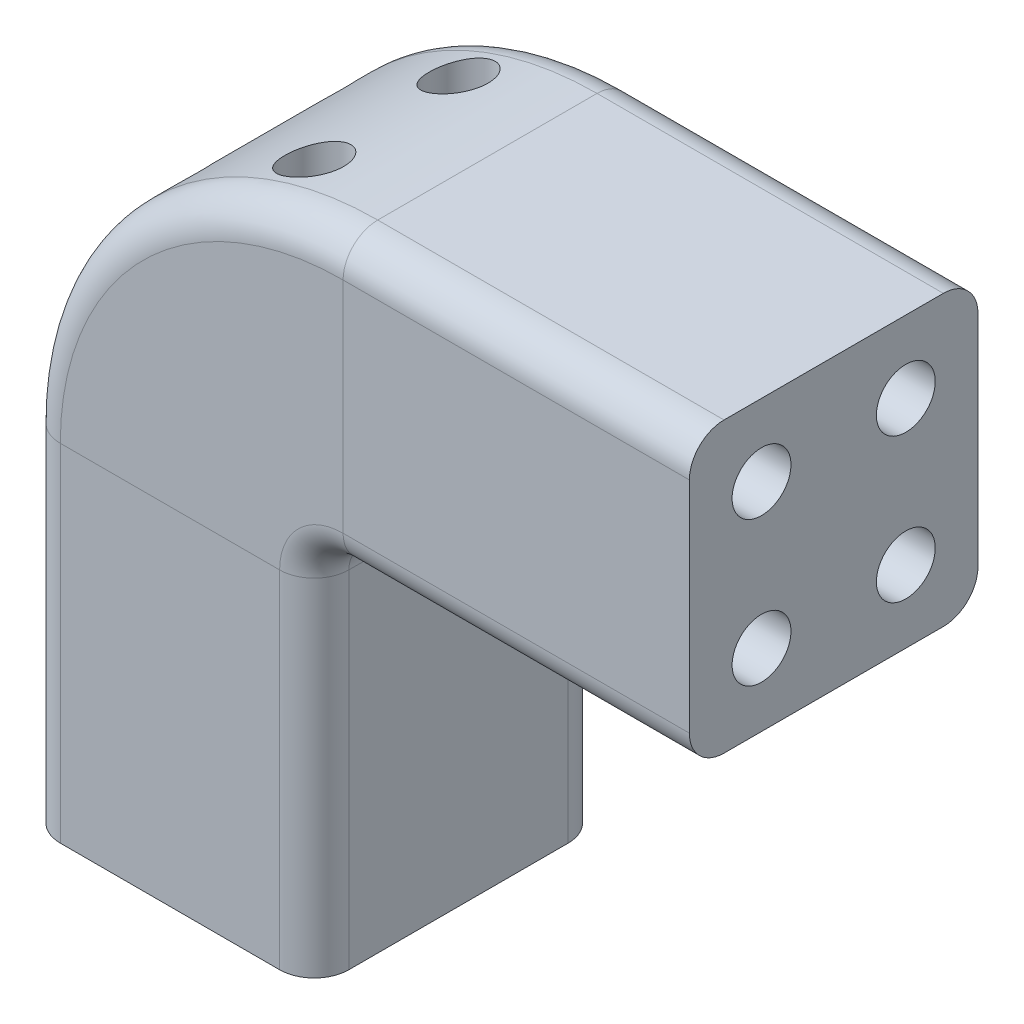
from build123d import *

# Parameters (mm, degrees)
SKETCH_3_R          = 2.55
CUT_EXTRUDE_1_DEPTH = 30
SKETCH_5_R          = 2.55
CUT_EXTRUDE_2_DEPTH = 75.077662045


with BuildPart() as part:
    # 扫描1: sweep along a path in 草图2
    with BuildLine(Plane.XY) as sweep_1_path:
        Line((0, 0), (0, 30))
        ThreePointArc((0, 30), (4.393398282, 40.606601718), (15, 45))
        Line((15, 45), (45, 45))
    # 草图1 → 扫描1 (sweep)
    with BuildSketch(Plane(origin=(0, 0, 0), x_dir=(1, 0, 0), z_dir=(0, 1, 0))):
        with BuildLine():
            Line((-9.5, 12.5), (9.5, 12.5))
            ThreePointArc((9.5, 12.5), (11.621320344, 11.621320344), (12.5, 9.5))
            Line((12.5, 9.5), (12.5, -9.5))
            ThreePointArc((12.5, -9.5), (11.621320344, -11.621320344), (9.5, -12.5))
            Line((9.5, -12.5), (-9.5, -12.5))
            ThreePointArc((-9.5, -12.5), (-11.621320344, -11.621320344), (-12.5, -9.5))
            Line((-12.5, -9.5), (-12.5, 9.5))
            ThreePointArc((-12.5, 9.5), (-11.621320344, 11.621320344), (-9.5, 12.5))
        make_face()
    sweep(path=sweep_1_path.line)

    # 草图3 → 切除-拉伸1 (cut)
    with BuildSketch(Plane(origin=(45, 0, 0), x_dir=(0, 0, -1), z_dir=(1, 0, 0))):
        with Locations(Location((6.25, 51.25, 0), (0, 0, 90))):
            Circle(SKETCH_3_R)
        with Locations(Location((6.25, 38.75, 0), (0, 0, 90))):
            Circle(SKETCH_3_R)
        with Locations(Location((-6.25, 38.75, 0), (0, 0, 90))):
            Circle(SKETCH_3_R)
        with Locations(Location((-6.25, 51.25, 0), (0, 0, 90))):
            Circle(SKETCH_3_R)
    extrude(amount=-CUT_EXTRUDE_1_DEPTH, mode=Mode.SUBTRACT)

    # 草图5 → 切除-拉伸2 (cut, through all)
    with BuildSketch(Plane.XZ):
        with Locations(Location((-6.25, 6.25, 0), (0, 0, 270))):
            Circle(SKETCH_5_R)
        with Locations(Location((6.25, 6.25, 0), (0, 0, 270))):
            Circle(SKETCH_5_R)
        with Locations(Location((-6.25, -6.25, 0), (0, 0, 270))):
            Circle(SKETCH_5_R)
        with Locations(Location((6.25, -6.25, 0), (0, 0, 270))):
            Circle(SKETCH_5_R)
    extrude(amount=-CUT_EXTRUDE_2_DEPTH, mode=Mode.SUBTRACT)


solid = part.part
